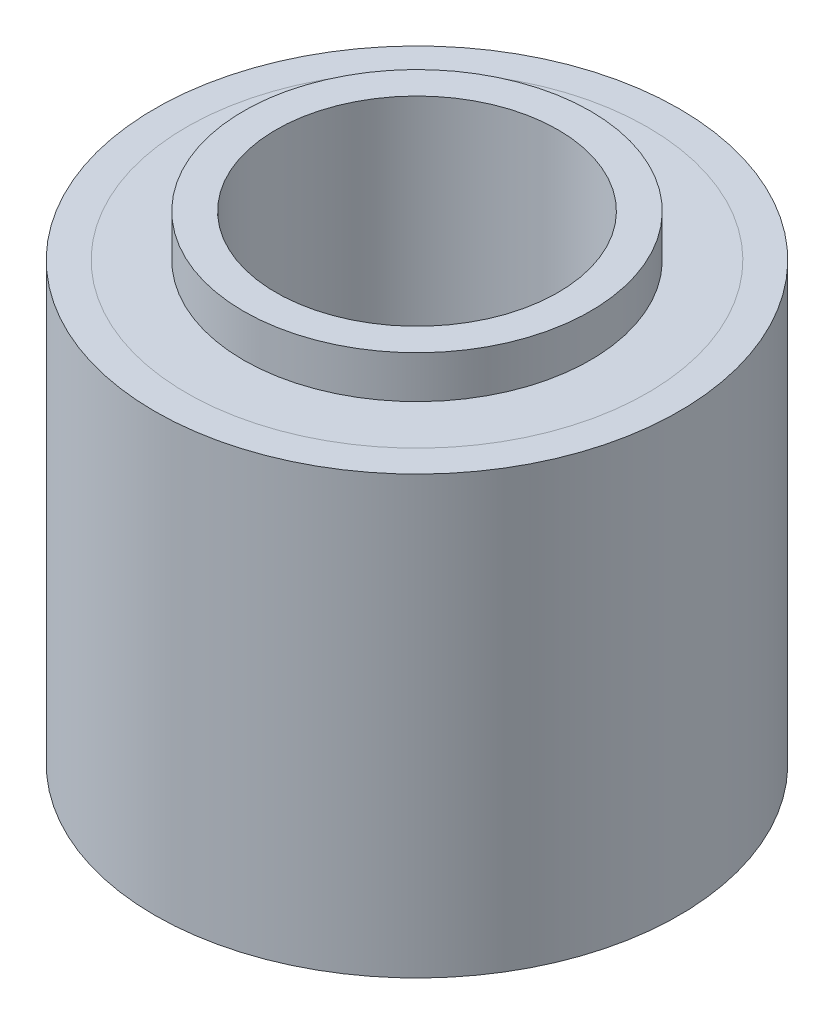
from build123d import *

# Parameters (mm, degrees)
IZIM1_W   = 1.99
IZIM1_H   = 29.4
IZIM1_W_2 = 1.95
IZIM1_H_2 = 26.8
IZIM4_W   = 3.5
IZIM4_H   = 26.8


with BuildPart() as part:
    # Çizim1 → Döndür1 (revolve)
    with BuildSketch(Plane.XY, mode=Mode.PRIVATE) as d_nd_r1_sk:
        with Locations((9.655, 14.7)):
            Rectangle(IZIM1_W, IZIM1_H)
        with Locations((15.125, 13.4)):
            Rectangle(IZIM1_W_2, IZIM1_H_2)
    revolve(d_nd_r1_sk.sketch.rotate(Axis((0, 0, 0), (0, 1, 0)), 90), axis=Axis((0, 0, 0), (0, 1, 0)))


with BuildPart() as body_2:
    # Çizim4 → Döndür3 (revolve)
    with BuildSketch(Plane.XY, mode=Mode.PRIVATE) as d_nd_r3_sk:
        with Locations((12.4, 13.4)):
            Rectangle(IZIM4_W, IZIM4_H)
    revolve(d_nd_r3_sk.sketch.rotate(Axis((0, 0, 0), (0, 1, 0)), 90), axis=Axis((0, 0, 0), (0, 1, 0)))


solid = Compound([part.part, body_2.part])
